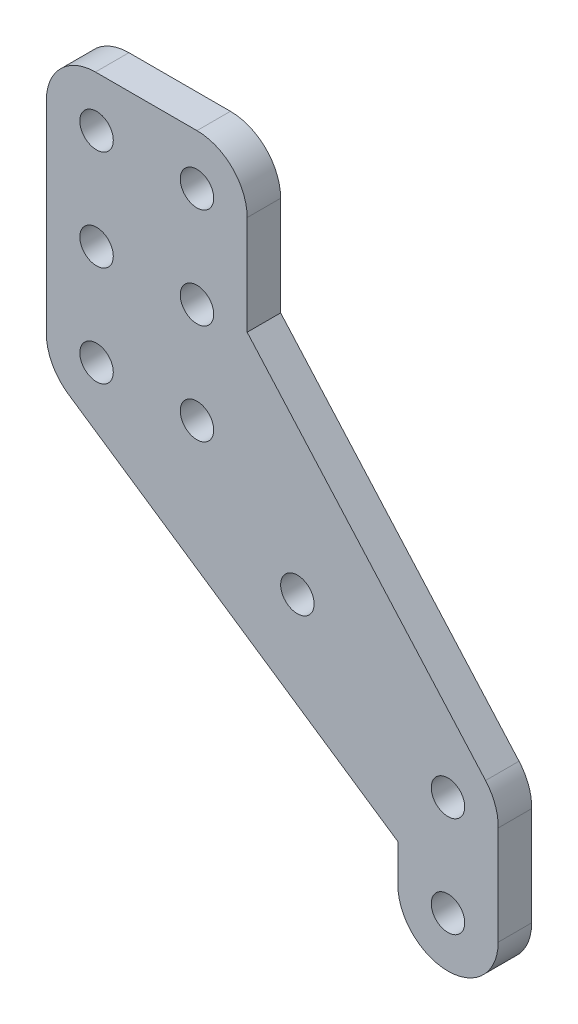
from build123d import *

# Parameters (mm, degrees)
MODEL_R                 = 1.5
SALIENTE_EXTRUIR1_DEPTH = 3


with BuildPart() as part:
    # Model → Saliente-Extruir1 (new body)
    with BuildSketch(Plane.XY):
        with BuildLine():
            Line((47.956564936, 294.416156902), (47.956564936, 276.316156902))
            ThreePointArc((47.956564936, 276.316156902), (48.482384187, 274.205259611), (49.936959325, 272.587673623))
            Line((49.936959325, 272.587673623), (70.456564936, 258.72109315))
            Line((70.456564936, 258.72109315), (79.456564936, 252.639142716))
            Line((79.456564936, 252.639142716), (79.456564936, 249.316156902))
            ThreePointArc((79.456564936, 249.316156902), (83.956564936, 244.816156902), (88.456564936, 249.316156902))
            Line((88.456564936, 249.316156902), (88.456564456, 249.318235809))
            Line((88.456564456, 249.318235809), (88.454517382, 258.180422621))
            ThreePointArc((88.454517382, 258.180422621), (88.187667044, 259.848401972), (87.32462533, 261.300477459))
            Line((87.32462533, 261.300477459), (65.956564936, 285.416156902))
            Line((65.956564936, 285.416156902), (65.956564936, 294.316156902))
            ThreePointArc((65.956564936, 294.316156902), (64.638545451, 297.498137417), (61.456564936, 298.816156902))
            Line((61.456564936, 298.816156902), (52.356564936, 298.816156902))
            ThreePointArc((52.356564936, 298.816156902), (49.245295099, 297.527426739), (47.956564936, 294.416156902))
        make_face()
        with Locations((83.956564936, 249.316156902)):
            Circle(MODEL_R, mode=Mode.SUBTRACT)
        with Locations((70.456564936, 267.316156902)):
            Circle(MODEL_R, mode=Mode.SUBTRACT)
        with Locations((83.956564936, 258.316156902)):
            Circle(MODEL_R, mode=Mode.SUBTRACT)
        with Locations((52.456564936, 276.316156902)):
            Circle(MODEL_R, mode=Mode.SUBTRACT)
        with Locations((61.456564936, 276.316156902)):
            Circle(MODEL_R, mode=Mode.SUBTRACT)
        with Locations((52.456564936, 285.316156902)):
            Circle(MODEL_R, mode=Mode.SUBTRACT)
        with Locations((52.456564936, 294.316156902)):
            Circle(MODEL_R, mode=Mode.SUBTRACT)
        with Locations((61.456564936, 285.316156902)):
            Circle(MODEL_R, mode=Mode.SUBTRACT)
        with Locations((61.456564936, 294.316156902)):
            Circle(MODEL_R, mode=Mode.SUBTRACT)
    extrude(amount=SALIENTE_EXTRUIR1_DEPTH)


solid = part.part
